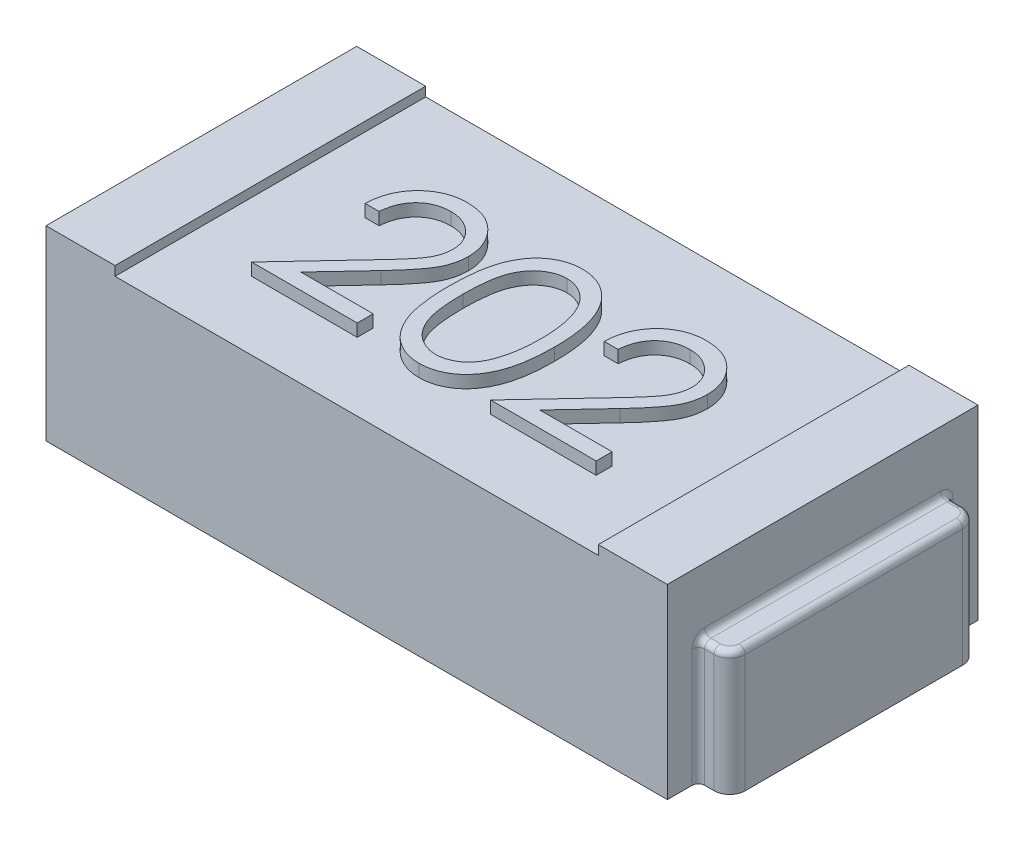
from build123d import *

# Parameters (mm, degrees)
ESQUISSE1_W             = 2
ESQUISSE1_H             = 1
BOSS_EXTRU_1_DEPTH      = 0.6
ESQUISSE2_W             = 1.555645222
ESQUISSE2_H             = 1
ENL_V_MAT_EXTRU_1_DEPTH = 0.03
BOSS_EXTRU_2_DEPTH      = 0.4
CONG_1_R                = 0.02
CONG_1_OF_SYM_TRIE2_R   = 0.02
BOSS_EXTRU_3_DEPTH      = 0.04


with BuildPart() as part:
    # Esquisse1 → Boss.-Extru.1 (new body)
    with BuildSketch(Plane(origin=(0, 0, 0), x_dir=(1, 0, 0), z_dir=(0, 1, 0))):
        Rectangle(ESQUISSE1_W, ESQUISSE1_H)
    extrude(amount=BOSS_EXTRU_1_DEPTH)

    # Esquisse2 → Enlèv. mat.-Extru.1 (cut)
    with BuildSketch(Plane(origin=(0, 0.6, 0), x_dir=(1, 0, 0), z_dir=(0, 1, 0))):
        Rectangle(ESQUISSE2_W, ESQUISSE2_H)
    extrude(amount=-ENL_V_MAT_EXTRU_1_DEPTH, mode=Mode.SUBTRACT)

    # Esquisse3 → Boss.-Extru.2 (add)
    with BuildSketch(Plane(origin=(0, 0, 0), x_dir=(1, 0, 0), z_dir=(0, 1, 0))):
        with BuildLine():
            Line((1, 0.4), (1.050552667, 0.4))
            ThreePointArc((1.050552667, 0.4), (1.085908006, 0.385355339), (1.100552667, 0.35))
            Line((1.100552667, 0.35), (1.100552667, -0.35))
            ThreePointArc((1.100552667, -0.35), (1.085908006, -0.385355339), (1.050552667, -0.4))
            Line((1.050552667, -0.4), (1, -0.4))
            Line((1, -0.4), (1, 0.4))
        make_face()
    boss_extru_2 = extrude(amount=BOSS_EXTRU_2_DEPTH)

    # Congé1
    cong_1_edges = [part.edges().sort_by_distance(p)[0] for p in [
        (1, 0.2, -0.4),
        (1, 0.2, 0.4),
        (1, 0.4, 0),
        (1.025276334, 0.4, 0.4),
        (1.085908006, 0.4, 0.385355339),
        (1.100552667, 0.4, 0),
        (1.085908006, 0.4, -0.385355339),
        (1.025276334, 0.4, -0.4),
    ]]
    fillet(cong_1_edges, radius=CONG_1_R)

    # Symétrie2: Boss.-Extru.2 across plane
    add(boss_extru_2.mirror(Plane(origin=(0, 0, 0), x_dir=(0, 0, 1), z_dir=(1, 0, 0))))

    # Congé1 of Symétrie2
    cong_1_of_sym_trie2_edges = [part.edges().sort_by_distance(p)[0] for p in [
        (-1, 0.2, -0.4),
        (-1, 0.2, 0.4),
        (-1, 0.4, 0),
        (-1.025276334, 0.4, 0.4),
        (-1.085908006, 0.4, 0.385355339),
        (-1.100552667, 0.4, 0),
        (-1.085908006, 0.4, -0.385355339),
        (-1.025276334, 0.4, -0.4),
    ]]
    fillet(cong_1_of_sym_trie2_edges, radius=CONG_1_OF_SYM_TRIE2_R)

    # Esquisse4 → Boss.-Extru.3 (add)
    # profile 1 of 3: a face of its own
    with BuildSketch(Plane(origin=(0, 0.57, 0), x_dir=(1, 0, 0), z_dir=(0, 1, 0))):
        with BuildLine():
            Line((0.275641026, 0.065854324), (0.230769231, 0.065854324))
            add(Edge.make_bspline(
                [(0.230769231, 0.065854324), (0.231061681, 0.071807307), (0.231636046, 0.08349881), (0.234325802, 0.100545082), (0.238174498, 0.116838625), (0.243616135, 0.132248612), (0.250374174, 0.146911299), (0.258478464, 0.160768444), (0.268077586, 0.173767185), (0.278964262, 0.18578702), (0.290788353, 0.196813816), (0.303546344, 0.206335994), (0.316952777, 0.214381375), (0.330966977, 0.221107267), (0.345747057, 0.226155816), (0.361158894, 0.229901765), (0.377270199, 0.232155528), (0.388247345, 0.232397784), (0.393830128, 0.23252099)],
                knots=[0, 0, 0, 0, 1.10065271, 2.161652631, 3.183658789, 4.190468796, 5.17591951, 6.163126047, 7.15150782, 8.156236427, 9.156009102, 10.134482811, 11.092018607, 12.041330605, 13.001268258, 13.972401359, 14.968799086, 16, 16, 16, 16], degree=3))
            add(Edge.make_bspline(
                [(0.393830128, 0.23252099), (0.39931271, 0.232392639), (0.410085788, 0.232140434), (0.425808933, 0.229974573), (0.440777118, 0.226582346), (0.454961085, 0.221823), (0.468247665, 0.215425225), (0.480736672, 0.207739862), (0.492576787, 0.198851315), (0.503234899, 0.188386485), (0.513021768, 0.177214715), (0.521464947, 0.165287872), (0.528695399, 0.152969403), (0.53472221, 0.140165374), (0.539158802, 0.126755227), (0.542527117, 0.112934198), (0.544431033, 0.098559225), (0.544723237, 0.088829717), (0.544871795, 0.08388317)],
                knots=[0, 0, 0, 0, 1.111607364, 2.184268762, 3.212621178, 4.221274766, 5.211760367, 6.196651075, 7.1921475, 8.207485113, 9.220403448, 10.201281604, 11.166441695, 12.114753415, 13.065576456, 14.026450734, 14.996634279, 16, 16, 16, 16], degree=3))
            add(Edge.make_bspline(
                [(0.544871795, 0.08388317), (0.5446299, 0.076919193), (0.544150356, 0.063113449), (0.540048302, 0.042825611), (0.533641657, 0.023169408), (0.525927749, 0.007349794), (0.518145972, -0.005397848), (0.511133471, -0.015893378), (0.502924212, -0.027194159), (0.493398712, -0.03926235), (0.482754016, -0.052192479), (0.470893707, -0.065976736), (0.45773321, -0.080472703), (0.448496281, -0.090373503), (0.443709936, -0.09550385)],
                knots=[0, 0, 0, 0, 1.184426356, 2.348067706, 3.509069118, 4.696110526, 5.333549288, 6.050745305, 6.844228056, 7.710549037, 8.667450064, 9.695053472, 10.805634456, 12, 12, 12, 12], degree=3))
            Line((0.443709936, -0.09550385), (0.318609776, -0.229017471))
            Line((0.318609776, -0.229017471), (0.551282051, -0.229017471))
            Line((0.551282051, -0.229017471), (0.551282051, -0.280299523))
            Line((0.551282051, -0.280299523), (0.211538462, -0.280299523))
            Line((0.211538462, -0.280299523), (0.405448718, -0.073368433))
            add(Edge.make_bspline(
                [(0.405448718, -0.073368433), (0.410169845, -0.068440103), (0.419238163, -0.058973791), (0.432064245, -0.045153368), (0.443584101, -0.032332005), (0.4538723, -0.020533927), (0.462705658, -0.00958656), (0.470544548, 0.000155541), (0.476825347, 0.009120462), (0.483641832, 0.019511978), (0.490243829, 0.032199452), (0.495917023, 0.047704265), (0.499376287, 0.063665301), (0.499791263, 0.074451306), (0.5, 0.079876759)],
                knots=[0, 0, 0, 0, 1.329631726, 2.553950428, 3.673215718, 4.687767853, 5.603093632, 6.413772471, 7.123043292, 7.734684054, 8.834405432, 9.900288307, 10.943827018, 12, 12, 12, 12], degree=3))
            add(Edge.make_bspline(
                [(0.5, 0.079876759), (0.49990918, 0.083288388), (0.49973019, 0.090012052), (0.498150519, 0.099870018), (0.495763304, 0.109379277), (0.492342553, 0.11856908), (0.487827304, 0.12734703), (0.482331107, 0.135723813), (0.47598967, 0.143822236), (0.468653774, 0.151415565), (0.460594985, 0.158370023), (0.452081521, 0.164530606), (0.443074363, 0.169679051), (0.433611489, 0.17389955), (0.423719279, 0.177210319), (0.413378601, 0.179504402), (0.402618027, 0.180944757), (0.395270385, 0.181139638), (0.391526442, 0.181238939)],
                knots=[0, 0, 0, 0, 0.991446411, 1.95395049, 2.89581595, 3.838931463, 4.798493298, 5.75982156, 6.748411868, 7.785213223, 8.824556874, 9.840280684, 10.836137867, 11.835679398, 12.848801643, 13.863922112, 14.911575587, 16, 16, 16, 16], degree=3))
            add(Edge.make_bspline(
                [(0.391526442, 0.181238939), (0.387616323, 0.181136791), (0.379937495, 0.180936191), (0.368663348, 0.179532953), (0.357908237, 0.177112119), (0.347645108, 0.173801165), (0.337856595, 0.169592801), (0.328590303, 0.164351123), (0.319867034, 0.158096338), (0.311670387, 0.15100483), (0.30411839, 0.143109459), (0.297483122, 0.134308036), (0.291685406, 0.124761262), (0.286626944, 0.114494898), (0.282518988, 0.103415786), (0.279379967, 0.091563257), (0.276896132, 0.078988774), (0.276066343, 0.07030519), (0.275641026, 0.065854324)],
                knots=[0, 0, 0, 0, 1.031018746, 2.02475058, 2.990194455, 3.934040569, 4.864654155, 5.795059489, 6.735614925, 7.690564532, 8.649604399, 9.611025574, 10.590972636, 11.591080095, 12.624614302, 13.701020113, 14.821632451, 16, 16, 16, 16], degree=3))
        make_face()
    # profile 2 of 3: a face of its own
    with BuildSketch(Plane(origin=(0, 0.57, 0), x_dir=(1, 0, 0), z_dir=(0, 1, 0))):
        with BuildLine():
            add(Edge.make_bspline(
                [(-0.173076923, -0.030499843), (-0.173030063, -0.022485931), (-0.172939038, -0.00691879), (-0.171926406, 0.01576473), (-0.170244214, 0.037044772), (-0.167938875, 0.056922352), (-0.16513345, 0.075402605), (-0.16138838, 0.092436141), (-0.157129408, 0.108101799), (-0.152193345, 0.122450663), (-0.14662366, 0.13567605), (-0.140561623, 0.148022507), (-0.133766653, 0.159471354), (-0.126627094, 0.170205324), (-0.11885394, 0.180048709), (-0.110668399, 0.189140518), (-0.101750988, 0.197270626), (-0.092404844, 0.20467724), (-0.082545349, 0.211170022), (-0.07245354, 0.216888984), (-0.062059953, 0.22177468), (-0.051336213, 0.225616171), (-0.040378704, 0.228789149), (-0.029149123, 0.230958998), (-0.017628929, 0.232324271), (-0.009853009, 0.232454795), (-0.005909455, 0.23252099)],
                knots=[0, 0, 0, 0, 1.646270934, 3.197905019, 4.663502075, 6.030701355, 7.308322542, 8.50163776, 9.611534131, 10.641858119, 11.616356847, 12.558055219, 13.465016945, 14.349605745, 15.204443733, 16.039544428, 16.859896111, 17.680448484, 18.487036065, 19.28249412, 20.06191084, 20.843045899, 21.620316918, 22.403196591, 23.190181807, 24, 24, 24, 24], degree=3))
            add(Edge.make_bspline(
                [(-0.005909455, 0.23252099), (-0.001932958, 0.232451302), (0.005975043, 0.232312715), (0.017666525, 0.230980723), (0.029087908, 0.228770563), (0.0401905, 0.225638995), (0.051065498, 0.221753898), (0.061627842, 0.21688431), (0.071943139, 0.211215901), (0.081847466, 0.204555347), (0.091449554, 0.197129307), (0.100513548, 0.18873464), (0.109040275, 0.179456109), (0.117136747, 0.169392986), (0.124573261, 0.158352259), (0.13165518, 0.146525958), (0.137994042, 0.133707263), (0.144098996, 0.120110053), (0.149368565, 0.105358102), (0.154120886, 0.089534565), (0.157960739, 0.072452538), (0.161159206, 0.054201646), (0.163637048, 0.034714862), (0.165441712, 0.01403396), (0.16639501, -0.007854667), (0.166574538, -0.022820074), (0.166666667, -0.030499843)],
                knots=[0, 0, 0, 0, 0.810914788, 1.612654377, 2.396697861, 3.181598691, 3.963628158, 4.749916497, 5.551656086, 6.361998678, 7.18212741, 8.025565596, 8.878627764, 9.750805457, 10.657531673, 11.591944965, 12.560506719, 13.57287815, 14.630710178, 15.753379473, 16.941251878, 18.199788006, 19.531962791, 20.947069417, 22.433333509, 24, 24, 24, 24], degree=3))
            add(Edge.make_bspline(
                [(0.166666667, -0.030499843), (0.166573583, -0.038146116), (0.166392214, -0.053044566), (0.165452398, -0.074834705), (0.163601165, -0.095405854), (0.161285453, -0.114807349), (0.158078172, -0.132958437), (0.154134577, -0.14992193), (0.14975596, -0.165771083), (0.144350989, -0.180376056), (0.138435173, -0.193940588), (0.131998717, -0.206607324), (0.125103027, -0.218488222), (0.117590349, -0.229488186), (0.109582719, -0.239685137), (0.100908749, -0.248899083), (0.091812951, -0.257352037), (0.082182606, -0.264873698), (0.072123813, -0.271457241), (0.061843945, -0.277344934), (0.051160605, -0.282092462), (0.040315897, -0.286168896), (0.029154702, -0.289283247), (0.017690932, -0.291436655), (0.005982898, -0.292946919), (-0.001931611, -0.29306213), (-0.005909455, -0.293120035)],
                knots=[0, 0, 0, 0, 1.561518951, 3.042555995, 4.452378317, 5.7783523, 7.031515105, 8.214008947, 9.334062868, 10.386615937, 11.391082383, 12.354592575, 13.286541444, 14.194233754, 15.072674879, 15.931287219, 16.775624067, 17.606195743, 18.42308326, 19.229000347, 20.022332153, 20.807536673, 21.593273796, 22.3848459, 23.188221202, 24, 24, 24, 24], degree=3))
            add(Edge.make_bspline(
                [(-0.005909455, -0.293120035), (-0.0098529, -0.293053413), (-0.017628604, -0.292922047), (-0.029150379, -0.291562943), (-0.040333585, -0.289377871), (-0.051233407, -0.286318356), (-0.061905766, -0.282573379), (-0.072205236, -0.277694282), (-0.082246333, -0.272075129), (-0.09200227, -0.265675783), (-0.101289721, -0.258344114), (-0.110160951, -0.25023493), (-0.118393096, -0.241145871), (-0.12605511, -0.231220454), (-0.133337123, -0.22054999), (-0.140035605, -0.208988794), (-0.146231441, -0.196582707), (-0.151894797, -0.183251577), (-0.156916034, -0.168800873), (-0.161351421, -0.153065276), (-0.164853444, -0.135905899), (-0.167851009, -0.117460561), (-0.170268778, -0.09765), (-0.171919396, -0.07646346), (-0.172939583, -0.053914145), (-0.173030308, -0.038447034), (-0.173076923, -0.030499843)],
                knots=[0, 0, 0, 0, 0.810891512, 1.598919785, 2.382837074, 3.152667961, 3.926044502, 4.706494248, 5.493654104, 6.291793342, 7.103789334, 7.925228297, 8.761435821, 9.622817696, 10.50288917, 11.416980706, 12.369136599, 13.353924996, 14.394355917, 15.514179734, 16.714354668, 17.994756427, 19.357759367, 20.818452758, 22.365282078, 24, 24, 24, 24], degree=3))
        make_face()
        with BuildLine():
            add(Edge.make_bspline(
                [(-0.128205128, -0.030299523), (-0.128188064, -0.036977908), (-0.128154947, -0.049939343), (-0.127289775, -0.068774095), (-0.126111171, -0.086341285), (-0.124590985, -0.102663218), (-0.122333421, -0.117684649), (-0.11980388, -0.131508889), (-0.116725582, -0.14406278), (-0.113083436, -0.155432467), (-0.108934994, -0.165810906), (-0.104405585, -0.175468222), (-0.099539767, -0.184518499), (-0.094094174, -0.192880443), (-0.088163451, -0.200581323), (-0.081881557, -0.207757442), (-0.075014045, -0.214157011), (-0.06551351, -0.221832276), (-0.052971157, -0.229763581), (-0.037168234, -0.236670165), (-0.020929884, -0.241010516), (-0.009908277, -0.241562481), (-0.004407051, -0.241837984)],
                knots=[0, 0, 0, 0, 1.459021318, 2.831673884, 4.118529203, 5.306027144, 6.411944654, 7.436330062, 8.375795394, 9.233974572, 10.042671642, 10.816086306, 11.563610507, 12.285937304, 12.993564865, 13.685989202, 14.367179055, 15.041617293, 16.353048772, 17.594441528, 18.799311195, 20, 20, 20, 20], degree=3))
            add(Edge.make_bspline(
                [(-0.004407051, -0.241837984), (0.001129759, -0.24160973), (0.012191948, -0.241153692), (0.028353919, -0.236753873), (0.044043957, -0.230115367), (0.056339949, -0.222265723), (0.065694598, -0.214790248), (0.072397025, -0.208416726), (0.078548746, -0.201280174), (0.084383328, -0.193580275), (0.089734625, -0.18516992), (0.094600787, -0.176089552), (0.099041266, -0.166313955), (0.101571129, -0.159489707), (0.102864583, -0.156000644)],
                knots=[0, 0, 0, 0, 1.353760809, 2.704726607, 4.075137775, 5.516104923, 6.260822281, 7.007110065, 7.778089737, 8.566572457, 9.372053459, 10.217411131, 11.088608312, 12, 12, 12, 12], degree=3))
            add(Edge.make_bspline(
                [(0.102864583, -0.156000644), (0.104371979, -0.151539253), (0.107432638, -0.142480715), (0.111377177, -0.128428765), (0.114483663, -0.113685513), (0.117278429, -0.098339068), (0.119186009, -0.082276253), (0.12072141, -0.06554677), (0.121625794, -0.048138004), (0.121737902, -0.036310148), (0.121794872, -0.030299523)],
                knots=[0, 0, 0, 0, 0.884706709, 1.796334032, 2.740027952, 3.714592787, 4.726048262, 5.777819803, 6.87074269, 8, 8, 8, 8], degree=3))
            add(Edge.make_bspline(
                [(0.121794872, -0.030299523), (0.121716273, -0.024289869), (0.121562518, -0.012533703), (0.120974805, 0.00468318), (0.119457152, 0.021035717), (0.117771564, 0.036594356), (0.115286246, 0.051272971), (0.11260656, 0.065194443), (0.109006386, 0.078186304), (0.105160704, 0.090451958), (0.100759219, 0.101852052), (0.095914114, 0.112439736), (0.090739577, 0.122266125), (0.085119257, 0.131304259), (0.079119874, 0.139594623), (0.072583081, 0.146970993), (0.065768171, 0.153661989), (0.056222858, 0.161299499), (0.043726531, 0.169086884), (0.028177153, 0.176253421), (0.011995633, 0.180368891), (0.001056568, 0.180949132), (-0.004407051, 0.181238939)],
                knots=[0, 0, 0, 0, 1.31362396, 2.569729283, 3.763502607, 4.902122613, 5.988968491, 7.01645872, 7.998833611, 8.933434873, 9.825090667, 10.667526885, 11.477055099, 12.250526234, 12.991942729, 13.710640831, 14.402115721, 15.076753259, 16.378508321, 17.609869233, 18.806226677, 20, 20, 20, 20], degree=3))
            add(Edge.make_bspline(
                [(-0.004407051, 0.181238939), (-0.009937136, 0.180948732), (-0.02100738, 0.18036779), (-0.037357087, 0.176268754), (-0.053029138, 0.169124045), (-0.06549242, 0.161273706), (-0.075044389, 0.153796804), (-0.081770488, 0.147313025), (-0.088077084, 0.140220703), (-0.093886756, 0.132449001), (-0.099328082, 0.124096805), (-0.104325369, 0.11509841), (-0.108827845, 0.105408216), (-0.112982779, 0.095034439), (-0.116636034, 0.083665733), (-0.119649458, 0.071127305), (-0.122433322, 0.057347035), (-0.124404075, 0.042244248), (-0.12615604, 0.025918226), (-0.127281947, 0.008307181), (-0.128157841, -0.01055916), (-0.12818905, -0.023587611), (-0.128205128, -0.030299523)],
                knots=[0, 0, 0, 0, 1.207732386, 2.417664972, 3.655092373, 4.956220595, 5.625982001, 6.301752483, 6.994047911, 7.697131622, 8.419323945, 9.170223765, 9.943494443, 10.752040957, 11.610060368, 12.549350801, 13.567764191, 14.679664412, 15.874934091, 17.154273443, 18.533957287, 20, 20, 20, 20], degree=3))
        make_face(mode=Mode.SUBTRACT)
    # profile 3 of 3: a face of its own
    with BuildSketch(Plane(origin=(0, 0.57, 0), x_dir=(1, 0, 0), z_dir=(0, 1, 0))):
        with BuildLine():
            Line((-0.493589744, 0.065854324), (-0.538461538, 0.065854324))
            add(Edge.make_bspline(
                [(-0.538461538, 0.065854324), (-0.538169088, 0.071807307), (-0.537594723, 0.08349881), (-0.534904968, 0.100545082), (-0.531056271, 0.116838625), (-0.525614635, 0.132248612), (-0.518856595, 0.146911299), (-0.510752305, 0.160768444), (-0.501153184, 0.173767185), (-0.490266507, 0.18578702), (-0.478442416, 0.196813816), (-0.465684425, 0.206335994), (-0.452277992, 0.214381375), (-0.438263792, 0.221107267), (-0.423483712, 0.226155816), (-0.408071875, 0.229901765), (-0.39196057, 0.232155528), (-0.380983424, 0.232397784), (-0.375400641, 0.23252099)],
                knots=[0, 0, 0, 0, 1.10065271, 2.161652631, 3.183658789, 4.190468796, 5.17591951, 6.163126047, 7.15150782, 8.156236427, 9.156009102, 10.134482811, 11.092018607, 12.041330605, 13.001268258, 13.972401359, 14.968799086, 16, 16, 16, 16], degree=3))
            add(Edge.make_bspline(
                [(-0.375400641, 0.23252099), (-0.369918059, 0.232392639), (-0.359144981, 0.232140434), (-0.343421836, 0.229974573), (-0.328453651, 0.226582346), (-0.314269685, 0.221823), (-0.300983104, 0.215425225), (-0.288494098, 0.207739862), (-0.276653982, 0.198851315), (-0.26599587, 0.188386485), (-0.256209001, 0.177214715), (-0.247765822, 0.165287872), (-0.24053537, 0.152969403), (-0.234508559, 0.140165374), (-0.230071968, 0.126755227), (-0.226703652, 0.112934198), (-0.224799736, 0.098559225), (-0.224507533, 0.088829717), (-0.224358974, 0.08388317)],
                knots=[0, 0, 0, 0, 1.111607364, 2.184268762, 3.212621178, 4.221274766, 5.211760367, 6.196651075, 7.1921475, 8.207485113, 9.220403448, 10.201281604, 11.166441695, 12.114753415, 13.065576456, 14.026450734, 14.996634279, 16, 16, 16, 16], degree=3))
            add(Edge.make_bspline(
                [(-0.224358974, 0.08388317), (-0.224600869, 0.076919193), (-0.225080414, 0.063113449), (-0.229182467, 0.042825611), (-0.235589112, 0.023169408), (-0.24330302, 0.007349794), (-0.251084798, -0.005397848), (-0.258097299, -0.015893378), (-0.266306557, -0.027194159), (-0.275832057, -0.03926235), (-0.286476753, -0.052192479), (-0.298337062, -0.065976736), (-0.31149756, -0.080472703), (-0.320734488, -0.090373503), (-0.325520833, -0.09550385)],
                knots=[0, 0, 0, 0, 1.184426356, 2.348067706, 3.509069118, 4.696110526, 5.333549288, 6.050745305, 6.844228056, 7.710549037, 8.667450064, 9.695053472, 10.805634456, 12, 12, 12, 12], degree=3))
            Line((-0.325520833, -0.09550385), (-0.450620994, -0.229017471))
            Line((-0.450620994, -0.229017471), (-0.217948718, -0.229017471))
            Line((-0.217948718, -0.229017471), (-0.217948718, -0.280299523))
            Line((-0.217948718, -0.280299523), (-0.557692308, -0.280299523))
            Line((-0.557692308, -0.280299523), (-0.363782051, -0.073368433))
            add(Edge.make_bspline(
                [(-0.363782051, -0.073368433), (-0.359060925, -0.068440103), (-0.349992606, -0.058973791), (-0.337166524, -0.045153368), (-0.325646669, -0.032332005), (-0.31535847, -0.020533927), (-0.306525112, -0.00958656), (-0.298686221, 0.000155541), (-0.292405423, 0.009120462), (-0.285588938, 0.019511978), (-0.27898694, 0.032199452), (-0.273313747, 0.047704265), (-0.269854482, 0.063665301), (-0.269439506, 0.074451306), (-0.269230769, 0.079876759)],
                knots=[0, 0, 0, 0, 1.329631726, 2.553950428, 3.673215718, 4.687767853, 5.603093632, 6.413772471, 7.123043292, 7.734684054, 8.834405432, 9.900288307, 10.943827018, 12, 12, 12, 12], degree=3))
            add(Edge.make_bspline(
                [(-0.269230769, 0.079876759), (-0.26932159, 0.083288388), (-0.269500579, 0.090012052), (-0.27108025, 0.099870018), (-0.273467465, 0.109379277), (-0.276888216, 0.11856908), (-0.281403465, 0.12734703), (-0.286899662, 0.135723813), (-0.2932411, 0.143822236), (-0.300576995, 0.151415565), (-0.308635784, 0.158370023), (-0.317149248, 0.164530606), (-0.326156406, 0.169679051), (-0.33561928, 0.17389955), (-0.34551149, 0.177210319), (-0.355852168, 0.179504402), (-0.366612742, 0.180944757), (-0.373960384, 0.181139638), (-0.377704327, 0.181238939)],
                knots=[0, 0, 0, 0, 0.991446411, 1.95395049, 2.89581595, 3.838931463, 4.798493298, 5.75982156, 6.748411868, 7.785213223, 8.824556874, 9.840280684, 10.836137867, 11.835679398, 12.848801643, 13.863922112, 14.911575587, 16, 16, 16, 16], degree=3))
            add(Edge.make_bspline(
                [(-0.377704327, 0.181238939), (-0.381614446, 0.181136791), (-0.389293274, 0.180936191), (-0.400567421, 0.179532953), (-0.411322533, 0.177112119), (-0.421585662, 0.173801165), (-0.431374174, 0.169592801), (-0.440640466, 0.164351123), (-0.449363736, 0.158096338), (-0.457560382, 0.15100483), (-0.465112379, 0.143109459), (-0.471747647, 0.134308036), (-0.477545363, 0.124761262), (-0.482603825, 0.114494898), (-0.486711781, 0.103415786), (-0.489850802, 0.091563257), (-0.492334638, 0.078988774), (-0.493164426, 0.07030519), (-0.493589744, 0.065854324)],
                knots=[0, 0, 0, 0, 1.031018746, 2.02475058, 2.990194455, 3.934040569, 4.864654155, 5.795059489, 6.735614925, 7.690564532, 8.649604399, 9.611025574, 10.590972636, 11.591080095, 12.624614302, 13.701020113, 14.821632451, 16, 16, 16, 16], degree=3))
        make_face()
    extrude(amount=BOSS_EXTRU_3_DEPTH)


solid = part.part
